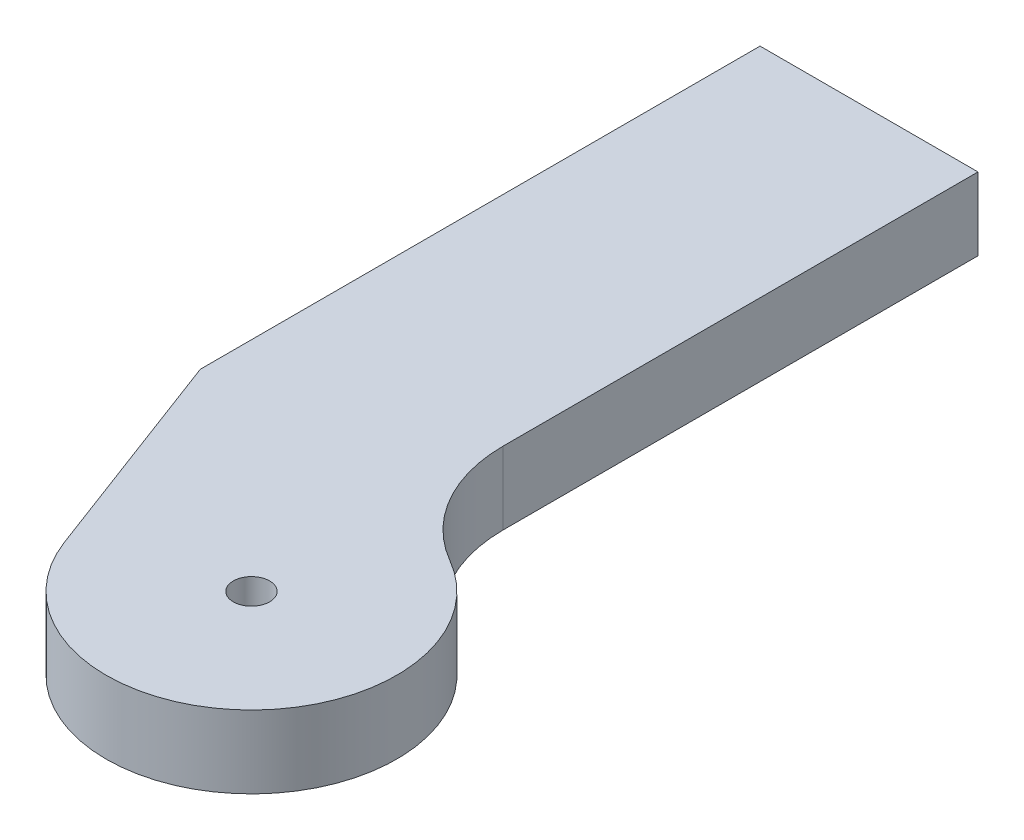
from build123d import *

# Parameters (mm, degrees)
BOSS_EXTRUDE1_DEPTH = 5
FILLET1_R           = 10
SKETCH2_R           = 1.25
CUT_EXTRUDE1_DEPTH  = 53.440442409


with BuildPart() as part:
    # Sketch1 → Boss-Extrude1 (new body)
    with BuildSketch(Plane(origin=(0, 0, 0), x_dir=(1, 0, 0), z_dir=(0, 1, 0))):
        with BuildLine():
            Line((0, 10), (0, 50))
            Line((0, 50), (-15, 50))
            Line((-15, 50), (-15, 11.480705826))
            Line((-15, 11.480705826), (-9.360265408, -3.519294174))
            ThreePointArc((-9.360265408, -3.519294174), (8.221707297, -5.692409782), (0, 10))
        make_face()
    extrude(amount=BOSS_EXTRUDE1_DEPTH)

    # Fillet1
    fillet1_edges = [part.edges().sort_by_distance(p)[0] for p in [
        (0, 2.5, -10),
    ]]
    fillet(fillet1_edges, radius=FILLET1_R)

    # Sketch2 → Cut-Extrude1 (cut, through all)
    with BuildSketch(Plane(origin=(0, 5, 0), x_dir=(1, 0, 0), z_dir=(0, 1, 0))):
        with Locations(Location((0, 0, 0), (0, 0, 270))):
            Circle(SKETCH2_R)
    extrude(amount=-CUT_EXTRUDE1_DEPTH, mode=Mode.SUBTRACT)


solid = part.part
